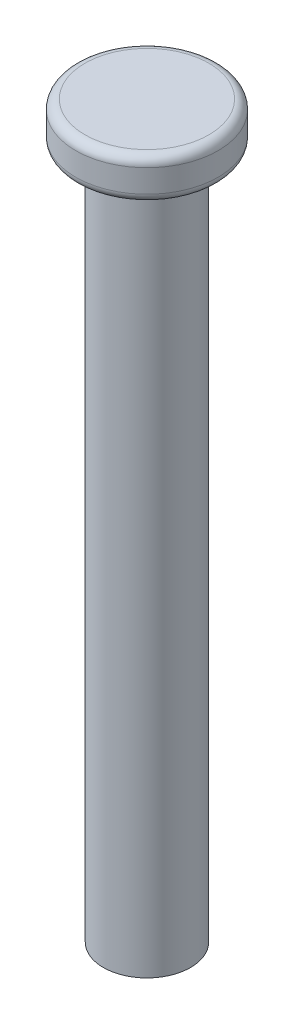
from build123d import *

# Parameters (mm, degrees)
SKETCH1_R           = 1.2065
BOSS_EXTRUDE1_DEPTH = 19.05
SKETCH2_R           = 1.9685
BOSS_EXTRUDE2_DEPTH = 1.143
FILLET1_R           = 0.254


with BuildPart() as part:
    # Sketch1 → Boss-Extrude1 (new body)
    with BuildSketch(Plane(origin=(0, 0, 0), x_dir=(1, 0, 0), z_dir=(0, 1, 0))):
        with Locations(Location((0, 0, 0), (0, 0, 90))):
            Circle(SKETCH1_R)
    extrude(amount=BOSS_EXTRUDE1_DEPTH)

    # Sketch2 → Boss-Extrude2 (add)
    with BuildSketch(Plane(origin=(0, 19.05, 0), x_dir=(1, 0, 0), z_dir=(0, 1, 0))):
        with Locations(Location((0, 0, 0), (0, 0, 270))):
            Circle(SKETCH2_R)
    extrude(amount=BOSS_EXTRUDE2_DEPTH)

    # Fillet1
    fillet1_edges = [part.edges().sort_by_distance(p)[0] for p in [
        (0, 19.05, -1.9685),
        (0, 20.193, -1.9685),
    ]]
    fillet(fillet1_edges, radius=FILLET1_R)


solid = part.part
